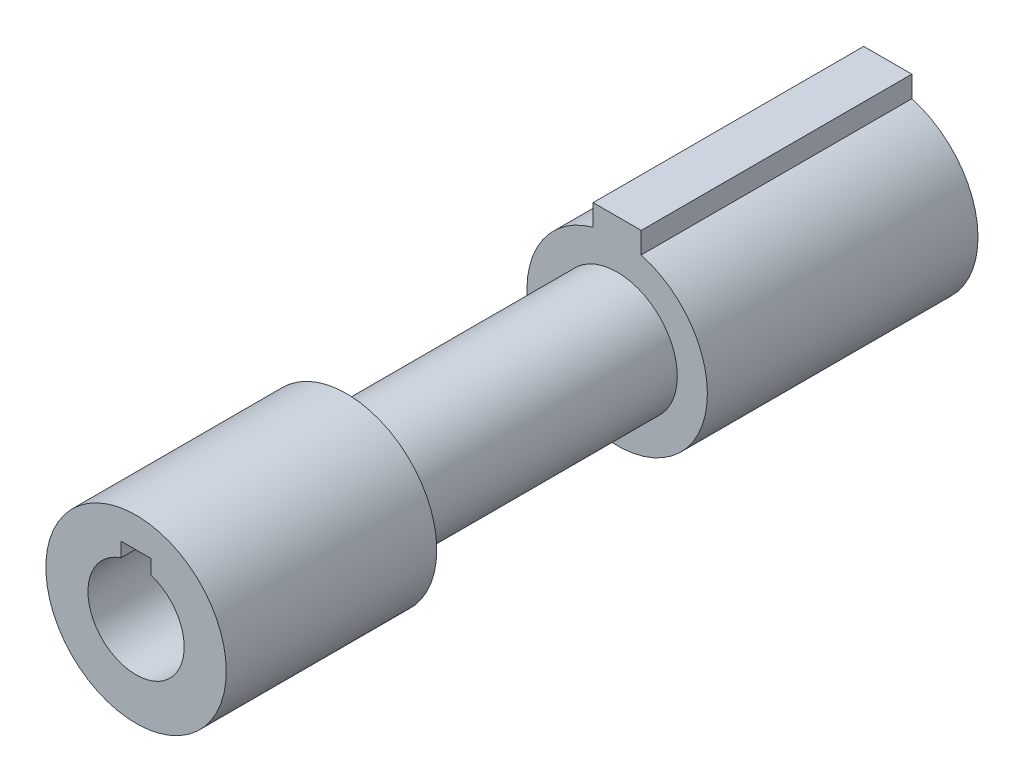
from build123d import *

# Parameters (mm, degrees)
SKETCH1_R                = 15
BOSS_EXTRUDE1_DEPTH      = 35
BOSS_EXTRUDE3_DEPTH      = 1
SKETCH2_R                = 10
BOSS_EXTRUDE4_DEPTH      = 50
BOSS_EXTRUDE5_DEPTH      = 40
BOSS_EXTRUDE5_DEPTH_BACK = 5
SKETCH4_R                = 10
CUT_EXTRUDE2_DEPTH       = 30


with BuildPart() as part:
    # Sketch1 → Boss-Extrude1 (new body)
    with BuildSketch(Plane.XY):
        Circle(SKETCH1_R)
        with BuildLine():
            Line((-2.5, 10), (2.5, 10))
            Line((2.5, 10), (2.5, 7.599342077))
            ThreePointArc((2.5, 7.599342077), (6.480740698, 4.69041576), (8, 0))
            ThreePointArc((8, 0), (-4.69041576, -6.480740698), (-2.5, 7.599342077))
            Line((-2.5, 7.599342077), (-2.5, 10))
        make_face(mode=Mode.SUBTRACT)
    extrude(amount=BOSS_EXTRUDE1_DEPTH)

    # Sketch1<6> → Boss-Extrude3 (add)
    with BuildSketch(Plane.XY):
        with BuildLine():
            Line((2.5, 7.599342077), (2.5, 10))
            Line((2.5, 10), (-2.5, 10))
            Line((-2.5, 10), (-2.5, 7.599342077))
            ThreePointArc((-2.5, 7.599342077), (0, 8), (2.5, 7.599342077))
        make_face()
    extrude(amount=BOSS_EXTRUDE3_DEPTH)

    # Sketch2 → Boss-Extrude4 (add)
    with BuildSketch(Plane.XY):
        Circle(SKETCH2_R)
    extrude(amount=-BOSS_EXTRUDE4_DEPTH)

    # Sketch3 → Boss-Extrude5 (add, two sides: drawn at the far end of the back side and taken through both)
    with BuildSketch(Plane(origin=(0, 0, -50), x_dir=(-1, 0, 0), z_dir=(0, 0, -1)).offset(-BOSS_EXTRUDE5_DEPTH_BACK)):
        with BuildLine():
            Line((4, 18), (-4, 18))
            Line((-4, 18), (-4, 14.456832295))
            ThreePointArc((-4, 14.456832295), (0, -15), (4, 14.456832295))
            Line((4, 14.456832295), (4, 18))
        make_face()
    extrude(amount=BOSS_EXTRUDE5_DEPTH + BOSS_EXTRUDE5_DEPTH_BACK)

    # Sketch4 → Cut-Extrude2 (cut)
    with BuildSketch(Plane(origin=(0, 0, -50), x_dir=(-1, 0, 0), z_dir=(0, 0, -1))):
        Circle(SKETCH4_R)
    extrude(amount=CUT_EXTRUDE2_DEPTH, mode=Mode.SUBTRACT)


solid = part.part
